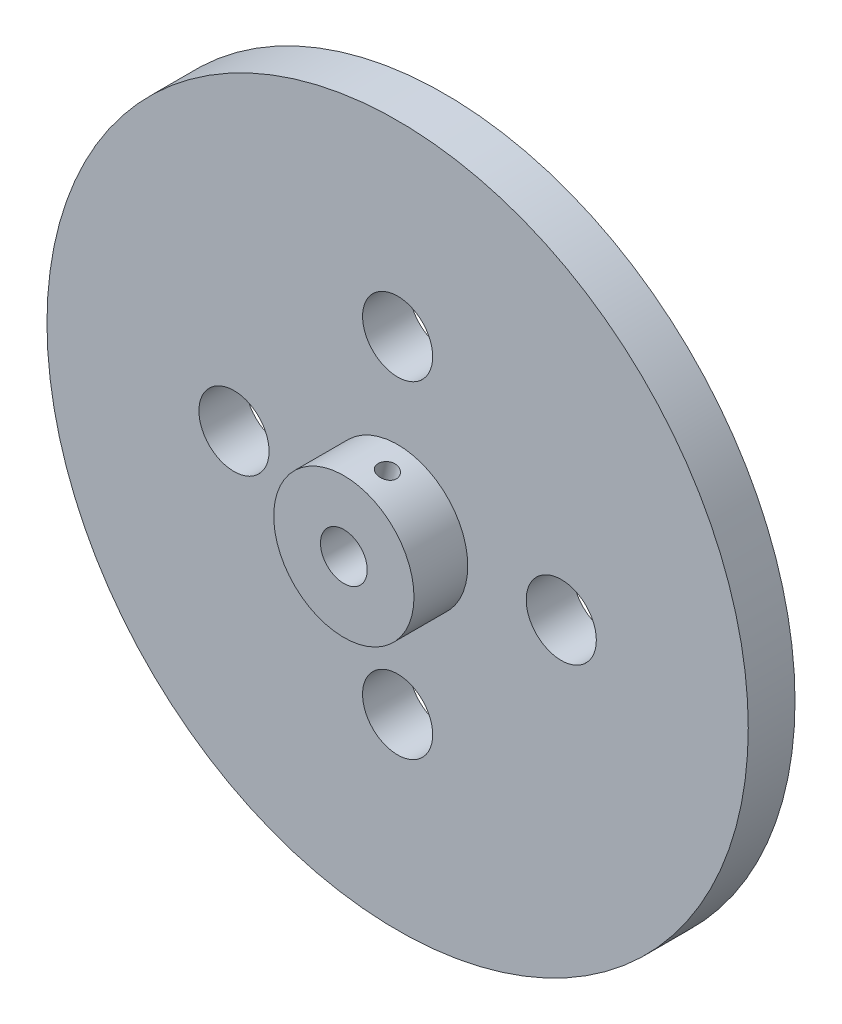
from build123d import *

# Parameters (mm, degrees)
SKETCH_1_R               = 15
EXTRUDE_1_DEPTH          = 2
SKETCH_2_R               = 3
SKETCH_2_R_2             = 1
EXTRUDE_2_DEPTH          = 2.3
SKETCH_3_R               = 1
CUT_EXTRUDE_1_DEPTH      = 6
SKETCH_4_R               = 1
CUT_EXTRUDE_2_DEPTH      = 22.644629819
SKETCH_5_R               = 1.5
CUT_EXTRUDE_3_DEPTH      = 10
CUT_EXTRUDE_4_DEPTH      = 2
CUT_EXTRUDE_4_DEPTH_BACK = 1.1
SKETCH_6_R               = 0.4


with BuildPart() as part:
    # 草图1 → 凸台-拉伸1 (new body)
    with BuildSketch(Plane.XY):
        Circle(SKETCH_1_R)
    extrude(amount=EXTRUDE_1_DEPTH)

    # 草图2 → 凸台-拉伸2 (add)
    with BuildSketch(Plane.XY.offset(2)):
        Circle(SKETCH_2_R)
        Circle(SKETCH_2_R_2, mode=Mode.SUBTRACT)
    extrude(amount=EXTRUDE_2_DEPTH)

    # 草图3 → 切除-拉伸1 (cut)
    with BuildSketch(Plane.XY.offset(2)):
        with Locations((0, 7)):
            Circle(SKETCH_3_R)
        with Locations((7, 0)):
            Circle(SKETCH_3_R)
        with Locations((0, -7)):
            Circle(SKETCH_3_R)
        with Locations((-7, 0)):
            Circle(SKETCH_3_R)
    extrude(amount=-CUT_EXTRUDE_1_DEPTH, mode=Mode.SUBTRACT)

    # 草图4 → 切除-拉伸2 (cut, through all)
    with BuildSketch(Plane(origin=(0, 0, 0), x_dir=(-1, 0, 0), z_dir=(0, 0, -1))):
        Circle(SKETCH_4_R)
    extrude(amount=-CUT_EXTRUDE_2_DEPTH, mode=Mode.SUBTRACT)

    # 草图5 → 切除-拉伸3 (cut)
    with BuildSketch(Plane.XY.offset(2)):
        with Locations((0, 7)):
            Circle(SKETCH_5_R)
        with Locations((-7, 0)):
            Circle(SKETCH_5_R)
        with Locations((7, 0)):
            Circle(SKETCH_5_R)
        with Locations((0, -7)):
            Circle(SKETCH_5_R)
    extrude(amount=-CUT_EXTRUDE_3_DEPTH, mode=Mode.SUBTRACT)

    # 草图6 → 切除-拉伸4 (cut, two sides: drawn at the far end of the back side and taken through both)
    with BuildSketch(Plane(origin=(64.521548832, -12.754908116, 46.976284772), x_dir=(0, 0, -1), z_dir=(-0.22357508845081375, -0.9746867085500914, 1.0628725110972871e-14)).offset(-CUT_EXTRUDE_4_DEPTH_BACK)):
        with Locations(Location((43.872176256, -65.74, 0), (0, 0, 270))):
            Circle(SKETCH_6_R)
    extrude(amount=CUT_EXTRUDE_4_DEPTH + CUT_EXTRUDE_4_DEPTH_BACK, mode=Mode.SUBTRACT)


solid = part.part
